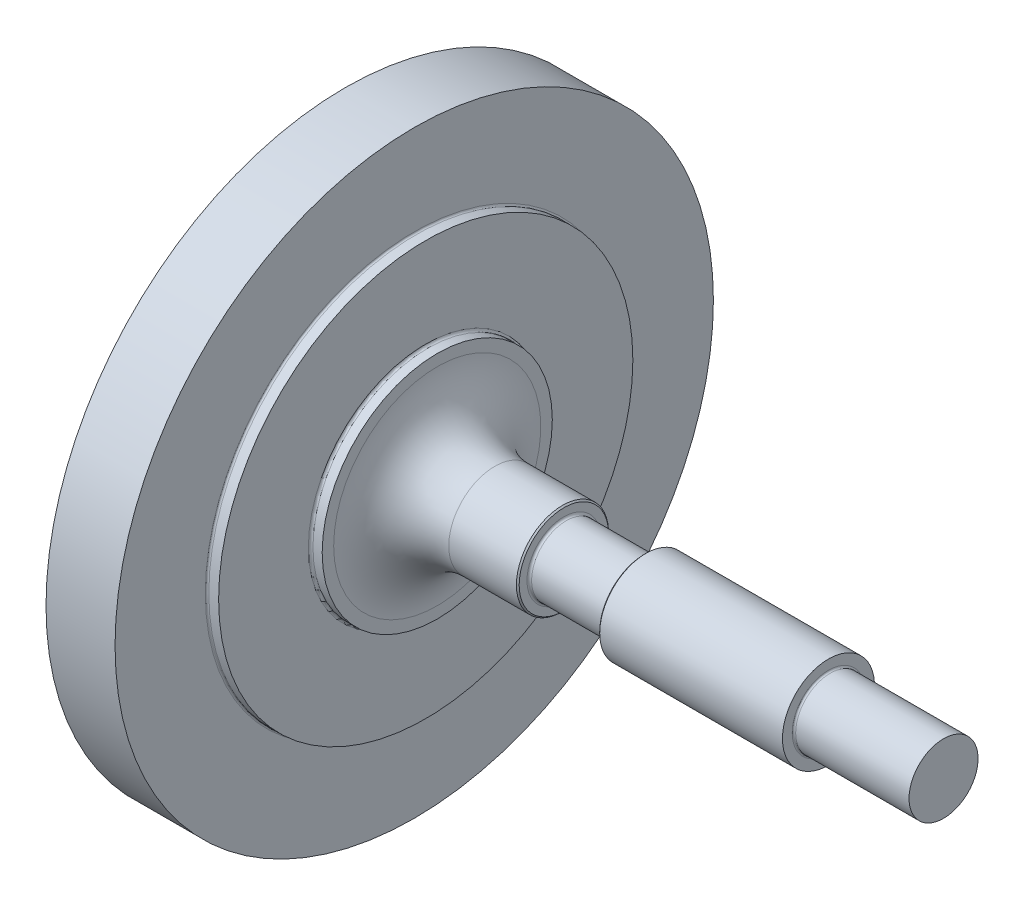
from build123d import *

# Parameters (mm, degrees)
CHAMFER1_SIZE = 0.3048


with BuildPart() as part:
    # Sketch2 → Base-Revolve (revolve)
    with BuildSketch(Plane.XY, mode=Mode.PRIVATE) as base_revolve_sk:
        with BuildLine():
            Line((-25.019, 7.62), (0, 7.62))
            Line((0, 7.62), (0, 0))
            Line((0, 0), (-142.24, 0))
            Line((-142.24, 0), (-142.24, 7.62))
            Line((-142.24, 7.62), (-137.668, 7.62))
            ThreePointArc((-137.668, 7.62), (-137.308789755, 7.768789755), (-137.16, 8.128))
            Line((-137.16, 8.128), (-137.16, 25.4))
            Line((-137.16, 25.4), (-135.128, 25.4))
            ThreePointArc((-135.128, 25.4), (-134.768789755, 25.548789755), (-134.62, 25.908))
            Line((-134.62, 25.908), (-134.62, 45.72))
            Line((-134.62, 45.72), (-132.588, 45.72))
            ThreePointArc((-132.588, 45.72), (-132.228789755, 45.868789755), (-132.08, 46.228))
            Line((-132.08, 46.228), (-132.08, 66.04))
            Line((-132.08, 66.04), (-116.84, 66.04))
            Line((-116.84, 66.04), (-116.84, 46.101))
            ThreePointArc((-116.84, 46.101), (-116.728407684, 45.831592316), (-116.459, 45.72))
            Line((-116.459, 45.72), (-114.3, 45.72))
            Line((-114.3, 45.72), (-114.3, 25.908))
            ThreePointArc((-114.3, 25.908), (-114.151210245, 25.548789755), (-113.792, 25.4))
            Line((-113.792, 25.4), (-111.76, 25.4))
            Line((-111.76, 25.4), (-111.76, 22.86))
            ThreePointArc((-111.76, 22.86), (-108.040256121, 13.879743879), (-99.06, 10.16))
            Line((-99.06, 10.16), (-83.82, 10.16))
            Line((-83.82, 10.16), (-83.82, 8.128))
            ThreePointArc((-83.82, 8.128), (-83.671210245, 7.768789755), (-83.312, 7.62))
            Line((-83.312, 7.62), (-66.548, 7.62))
            ThreePointArc((-66.548, 7.62), (-66.188789755, 7.768789755), (-66.04, 8.128))
            Line((-66.04, 8.128), (-66.04, 10.16))
            Line((-66.04, 10.16), (-25.4, 10.16))
            Line((-25.4, 10.16), (-25.4, 8.001))
            ThreePointArc((-25.4, 8.001), (-25.288407684, 7.731592316), (-25.019, 7.62))
        make_face()
    revolve(base_revolve_sk.sketch.rotate(Axis((12.7, 0, 0), (1, 0, 0)), 90), axis=Axis((12.7, 0, 0), (1, 0, 0)))

    # Chamfer1
    chamfer1_edges = [part.edges().sort_by_distance(p)[0] for p in [
        (-83.82, 0, -10.16),
        (-66.04, 0, -10.16),
    ]]
    chamfer(chamfer1_edges, length=CHAMFER1_SIZE)


solid = part.part
